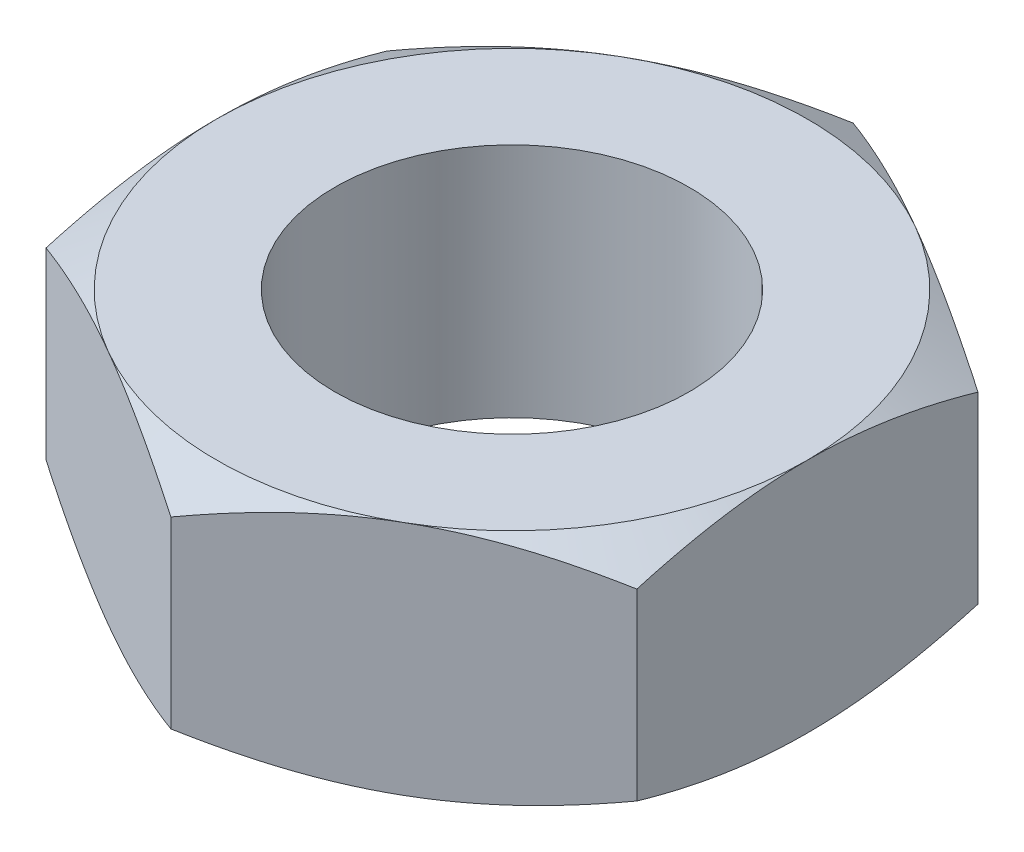
from build123d import *

# Parameters (mm, degrees)
SKETCH1_R           = 1.5
BOSS_EXTRUDE1_DEPTH = 2
SKETCH2_OUTSIDE_W   = 15.508
SKETCH2_OUTSIDE_H   = 16.282
SKETCH2_OUTSIDE_R   = 2.5
CUT_EXTRUDE1_DEPTH  = 2
CUT_EXTRUDE1_DRAFT  = -60
SKETCH3_OUTSIDE_W   = 15.508
SKETCH3_OUTSIDE_H   = 16.282
SKETCH3_OUTSIDE_R   = 2.5
CUT_EXTRUDE2_DEPTH  = 2
CUT_EXTRUDE2_DRAFT  = -60


with BuildPart() as part:
    # Sketch1 → Boss-Extrude1 (new body)
    with BuildSketch(Plane(origin=(0, 0, 0), x_dir=(1, 0, 0), z_dir=(0, 1, 0))):
        Polygon((0, -2.886751346), (2.5, -1.443375673), (2.5, 1.443375673), (0, 2.886751346), (-2.5, 1.443375673), (-2.5, -1.443375673), align=None)
        with Locations(Location((0, 0, 0), (0, 0, 270))):
            Circle(SKETCH1_R, mode=Mode.SUBTRACT)
    extrude(amount=BOSS_EXTRUDE1_DEPTH)


with BuildPart() as cut_extrude1_tool:
    # Sketch2 outside → Cut-Extrude1 (with draft: the straight prism first)
    with BuildSketch(Plane(origin=(0, 2, 0), x_dir=(1, 0, 0), z_dir=(0, 1, 0))):
        Rectangle(SKETCH2_OUTSIDE_W, SKETCH2_OUTSIDE_H)
        Circle(SKETCH2_OUTSIDE_R, mode=Mode.SUBTRACT)
    extrude(amount=-CUT_EXTRUDE1_DEPTH)
    # Cut-Extrude1: the draft: its side faces are tilted about the plane it starts from
    cut_extrude1_sides = [cut_extrude1_tool.faces().sort_by_distance(p)[0] for p in [
        (0, 1, 8.141),
        (7.754, 1, 0),
        (0, 1, -8.141),
        (-7.754, 1, 0),
        (-2.5, 1, 0),
    ]]
    draft(cut_extrude1_sides, Plane(origin=(0, 2, 0), x_dir=(1, 0, 0), z_dir=(0, 1, 0)), CUT_EXTRUDE1_DRAFT)


with BuildPart() as part_1:
    add(part.part)

    # Cut-Extrude1: cut by cut_extrude1_tool
    add(cut_extrude1_tool.part, mode=Mode.SUBTRACT)


with BuildPart() as cut_extrude2_tool:
    # Sketch3 outside → Cut-Extrude2 (with draft: the straight prism first)
    with BuildSketch(Plane.XZ):
        Rectangle(SKETCH3_OUTSIDE_W, SKETCH3_OUTSIDE_H)
        Circle(SKETCH3_OUTSIDE_R, mode=Mode.SUBTRACT)
    extrude(amount=-CUT_EXTRUDE2_DEPTH)
    # Cut-Extrude2: the draft: its side faces are tilted about the plane it starts from
    cut_extrude2_sides = [cut_extrude2_tool.faces().sort_by_distance(p)[0] for p in [
        (0, 1, -8.141),
        (7.754, 1, 0),
        (0, 1, 8.141),
        (-7.754, 1, 0),
        (-2.5, 1, 0),
    ]]
    draft(cut_extrude2_sides, Plane.XZ, CUT_EXTRUDE2_DRAFT)


with BuildPart() as part_2:
    add(part_1.part)

    # Cut-Extrude2: cut by cut_extrude2_tool
    add(cut_extrude2_tool.part, mode=Mode.SUBTRACT)


solid = part_2.part
